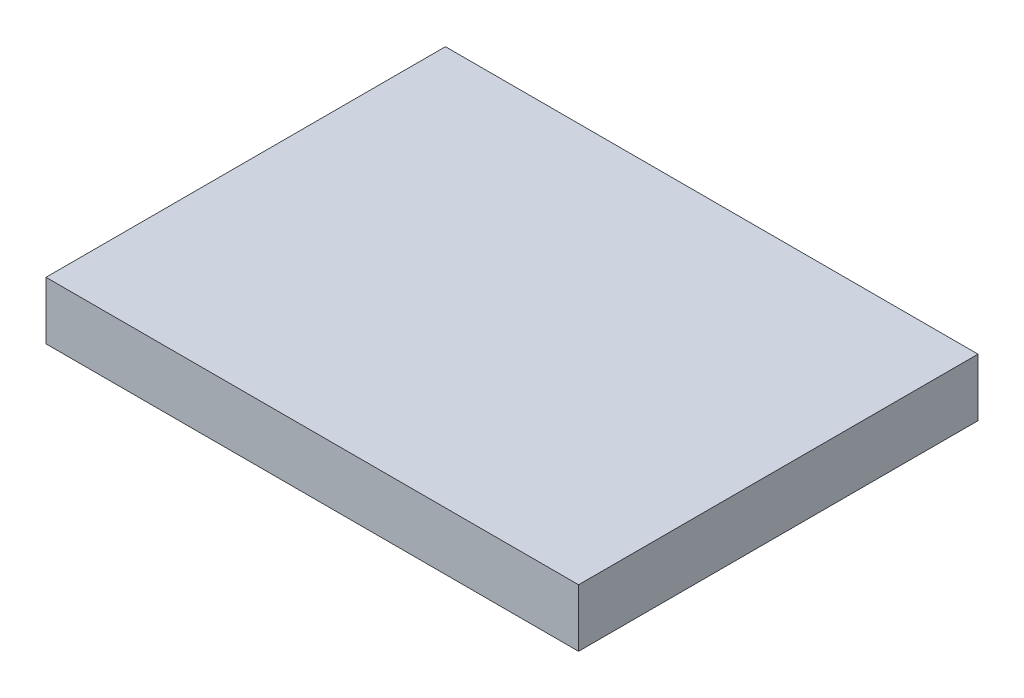
from build123d import *

# Parameters (mm, degrees)
SKETCH1_W           = 40.64
SKETCH1_H           = 30.48
BOSS_EXTRUDE1_DEPTH = 4.4


with BuildPart() as part:
    # Sketch1 → Boss-Extrude1 (new body)
    with BuildSketch(Plane(origin=(0, 0, 0), x_dir=(1, 0, 0), z_dir=(0, 1, 0))):
        with Locations((20.32, 15.24)):
            Rectangle(SKETCH1_W, SKETCH1_H)
    extrude(amount=BOSS_EXTRUDE1_DEPTH)


solid = part.part
